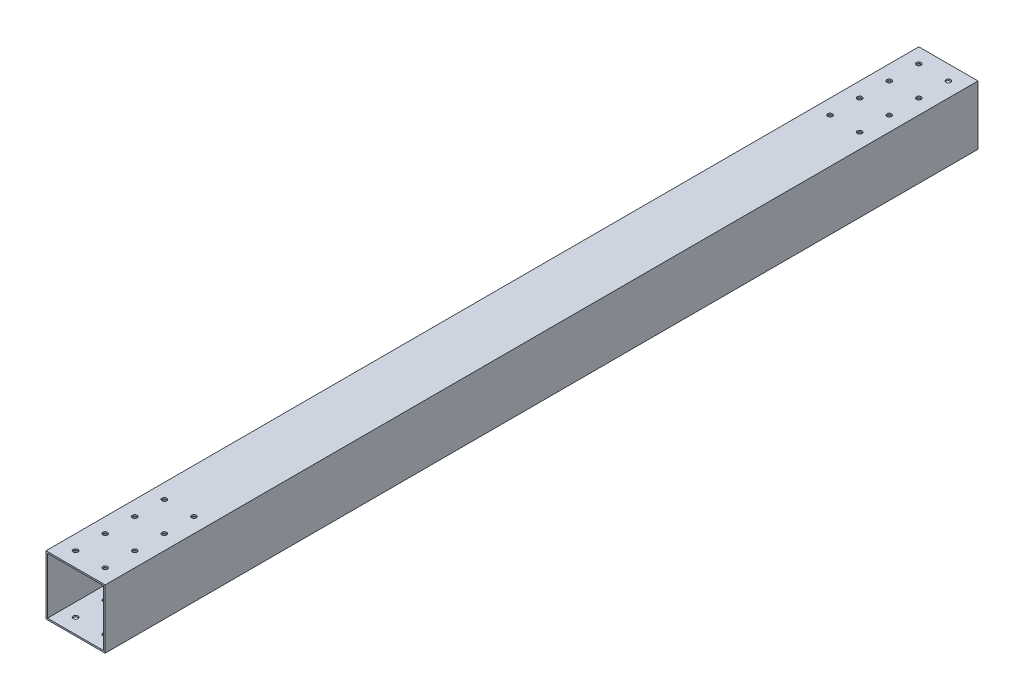
from build123d import *

# Parameters (mm, degrees)
SKETCH_1_W          = 40
SKETCH_1_H          = 40
SKETCH_1_W_2        = 38
SKETCH_1_H_2        = 38
EXTRUDE_1_DEPTH     = 295
SKETCH_2_R          = 1.6
CUT_EXTRUDE_1_DEPTH = 299.370574957


with BuildPart() as part:
    # 草图1 → 凸台-拉伸1 (new, symmetric)
    with BuildSketch(Plane.XY):
        Rectangle(SKETCH_1_W, SKETCH_1_H)
        Rectangle(SKETCH_1_W_2, SKETCH_1_H_2, mode=Mode.SUBTRACT)
    extrude(amount=EXTRUDE_1_DEPTH, both=True)

    # 草图2 → 切除-拉伸1 (cut, through all)
    with BuildSketch(Plane(origin=(0, 20, 0), x_dir=(1, 0, 0), z_dir=(0, 1, 0))):
        with Locations(Location((-10, -285, 0), (0, 0, 270))):
            Circle(SKETCH_2_R)
        with Locations(Location((10, -285, 0), (0, 0, 270))):
            Circle(SKETCH_2_R)
        with Locations(Location((-10, -265, 0), (0, 0, 270))):
            Circle(SKETCH_2_R)
        with Locations(Location((10, -265, 0), (0, 0, 270))):
            Circle(SKETCH_2_R)
        with Locations(Location((-10, -245, 0), (0, 0, 270))):
            Circle(SKETCH_2_R)
        with Locations(Location((10, -245, 0), (0, 0, 270))):
            Circle(SKETCH_2_R)
        with Locations(Location((-10, -225, 0), (0, 0, 270))):
            Circle(SKETCH_2_R)
        with Locations(Location((10, -225, 0), (0, 0, 270))):
            Circle(SKETCH_2_R)
        with Locations(Location((10, 225, 0), (0, 0, 270))):
            Circle(SKETCH_2_R)
        with Locations(Location((-10, 225, 0), (0, 0, 270))):
            Circle(SKETCH_2_R)
        with Locations(Location((10, 245, 0), (0, 0, 270))):
            Circle(SKETCH_2_R)
        with Locations(Location((-10, 245, 0), (0, 0, 270))):
            Circle(SKETCH_2_R)
        with Locations(Location((10, 265, 0), (0, 0, 270))):
            Circle(SKETCH_2_R)
        with Locations(Location((-10, 265, 0), (0, 0, 270))):
            Circle(SKETCH_2_R)
        with Locations(Location((10, 285, 0), (0, 0, 270))):
            Circle(SKETCH_2_R)
        with Locations(Location((-10, 285, 0), (0, 0, 270))):
            Circle(SKETCH_2_R)
    extrude(amount=-CUT_EXTRUDE_1_DEPTH, mode=Mode.SUBTRACT)


solid = part.part
